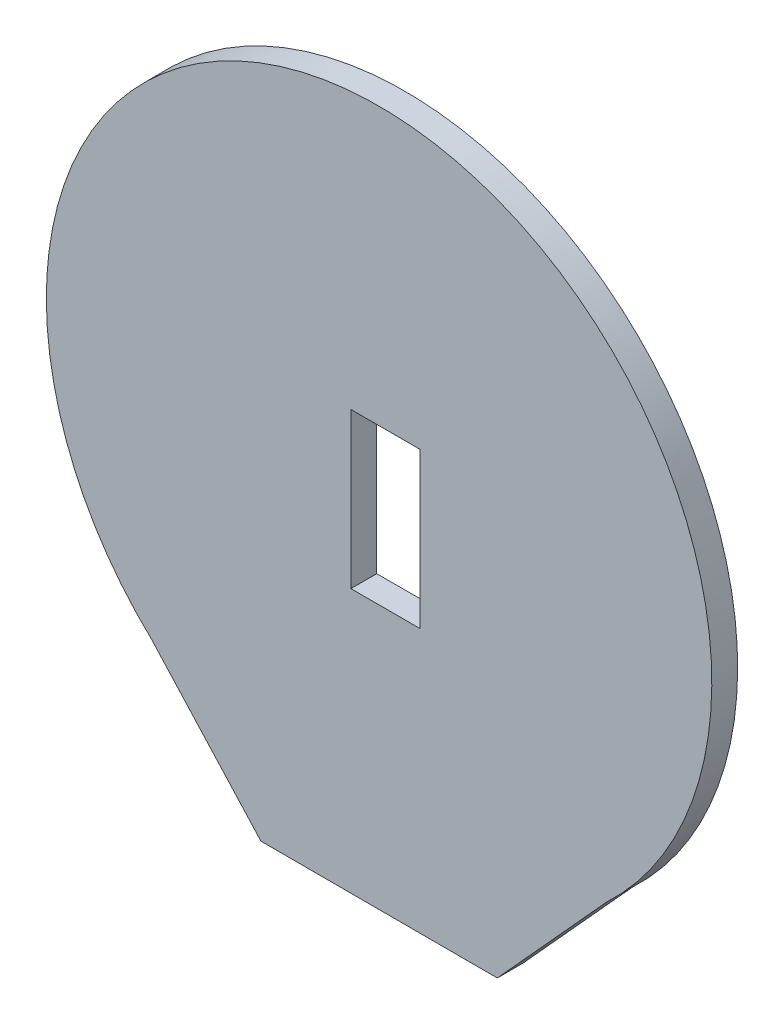
from build123d import *

# Parameters (mm, degrees)
BOSS_EXTRUDE1_DEPTH = 1.5
CUT_EXTRUDE1_REACH  = 38.943
SKETCH2_W           = 4
SKETCH2_H           = 9


with BuildPart() as part:
    # Sketch1 → Boss-Extrude1 (new body)
    with BuildSketch(Plane.XY):
        with BuildLine():
            Line((-17.310520711, -21.823889376), (-3.597740248, -21.843555797))
            Line((-3.597740248, -21.843555797), (2.757908107, -14.842465178))
            ThreePointArc((2.757908107, -14.842465178), (-10.455115829, 18.525441507), (-23.668139764, -14.842465178))
            Line((-23.668139764, -14.842465178), (-17.310520711, -21.823889376))
        make_face()
    extrude(amount=BOSS_EXTRUDE1_DEPTH)

    # Sketch2 → Cut-Extrude1 (cut, up to next)
    with BuildSketch(Plane.XY.offset(1.5), mode=Mode.PRIVATE) as cut_extrude1_sk1:
        with Locations((-10.090473375, -2.029514736)):
            Rectangle(SKETCH2_W, SKETCH2_H)
    cut_extrude1_tool1 = extrude(cut_extrude1_sk1.sketch, amount=-CUT_EXTRUDE1_REACH, mode=Mode.PRIVATE) & part.part
    add(cut_extrude1_tool1.solids().sort_by_distance((-10.090473, -2.029515, 1.5))[0], mode=Mode.SUBTRACT)


solid = part.part
